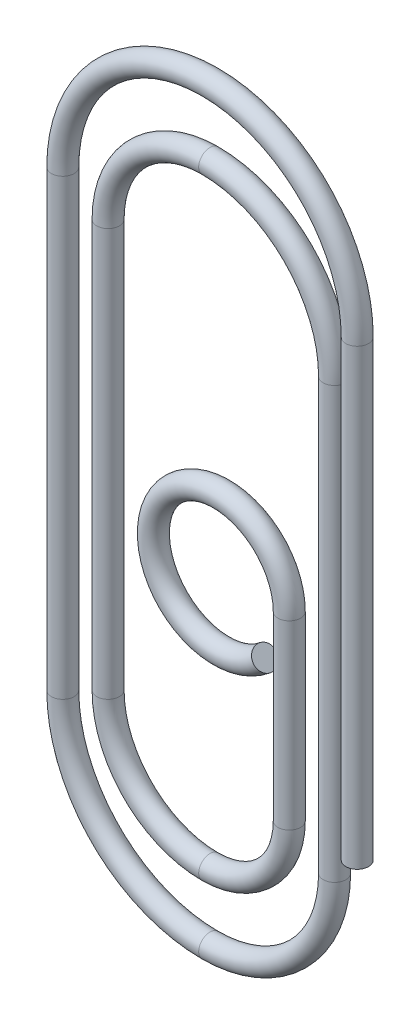
from build123d import *

# Parameters (mm, degrees)
SKETCH_3_R = 2.5


with BuildPart() as part:
    # По траектории1: sweep along a path in Эскиз2
    with BuildLine(Plane.XY) as sweep_1_path:
        Line((30, -40), (30, 60))
        ThreePointArc((30, 60), (-2.5, 92.5), (-35, 60))
        Line((-35, 60), (-35, -40))
        ThreePointArc((-35, -40), (-25.480970389, -62.980970389), (-2.5, -72.5))
        ThreePointArc((-2.5, -72.5), (16.945436483, -64.445436483), (25, -45))
        Line((25, -45), (25, 50))
        ThreePointArc((25, 50), (16.945436483, 69.445436483), (-2.5, 77.5))
        ThreePointArc((-2.5, 77.5), (-18.409902577, 70.909902577), (-25, 55))
        Line((-25, 55), (-25, -35))
        ThreePointArc((-25, -35), (-18.409902577, -50.909902577), (-2.5, -57.5))
        ThreePointArc((-2.5, -57.5), (9.874368671, -52.374368671), (15, -40))
        Line((15, -40), (15, 0))
        ThreePointArc((15, 0), (-13.594616806, 6.339273926), (9.641814145, -11.490666647))
    # Эскиз3 → По траектории1 (sweep)
    with BuildSketch(Plane(origin=(9.641814145, -11.490666647, 0), x_dir=(0, 0, -1), z_dir=(0.7660444431189765, 0.6427876096865413, 0))):
        Circle(SKETCH_3_R)
    sweep(path=sweep_1_path.line)


solid = part.part
